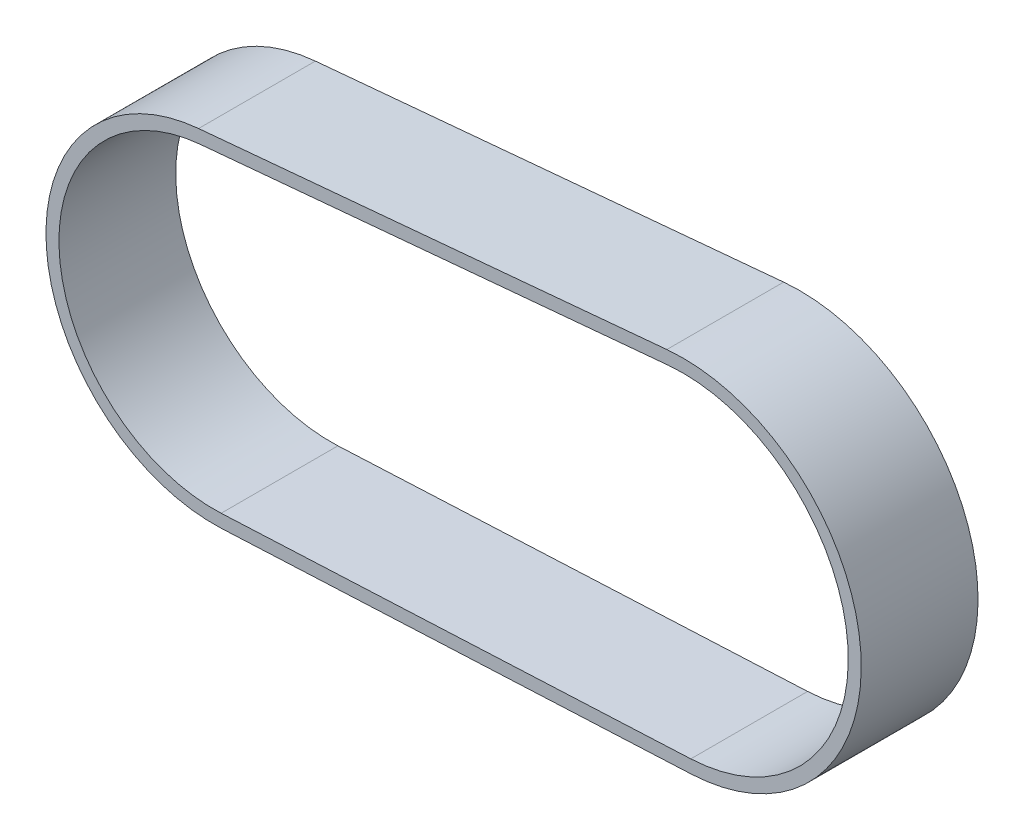
from build123d import *

# Parameters (mm, degrees)
EXTRUDE_THIN1_DEPTH = 9


with BuildPart() as part:
    # Sketch2 → Extrude-Thin1 (new body)
    with BuildSketch(Plane.XY):
        with BuildLine():
            Line((36.801180622, -11.217180761), (0.608798914, -12.922287717))
            ThreePointArc((0.608798914, -12.922287717), (-12.905804339, -0.892395827), (-1.175562428, 12.883097801))
            Line((-1.175562428, 12.883097801), (34.907057259, 16.175580142))
            ThreePointArc((34.907057259, 16.175580142), (49.854615891, 3.447290073), (36.801180622, -11.217180761))
        make_face()
        with BuildLine():
            Line((36.754120503, -10.218288702), (0.561738795, -11.923395658))
            ThreePointArc((0.561738795, -11.923395658), (-11.908186445, -0.823413684), (-1.084691523, 11.88723512))
            Line((-1.084691523, 11.88723512), (34.997928163, 15.179717461))
            ThreePointArc((34.997928163, 15.179717461), (48.856997996, 3.378307929), (36.754120503, -10.218288702))
        make_face(mode=Mode.SUBTRACT)
    extrude(amount=EXTRUDE_THIN1_DEPTH)


solid = part.part
